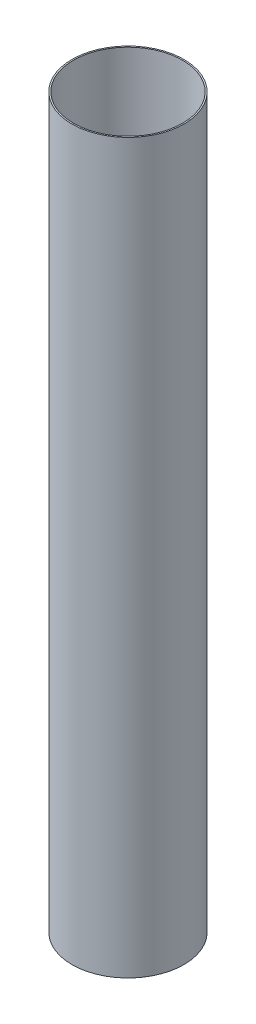
from build123d import *

# Parameters (mm, degrees)
SKETCH2_R   = 40
SKETCH2_R_2 = 39
BODY_DEPTH  = 520


with BuildPart() as part:
    # Sketch2 → body (new body)
    with BuildSketch(Plane(origin=(0, 0, 0), x_dir=(1, 0, 0), z_dir=(0, 1, 0))):
        with Locations(Location((0, 0, 0), (0, 0, 270))):
            Circle(SKETCH2_R)
        with Locations(Location((0, 0, 0), (0, 0, 270))):
            Circle(SKETCH2_R_2, mode=Mode.SUBTRACT)
    extrude(amount=BODY_DEPTH)


solid = part.part
